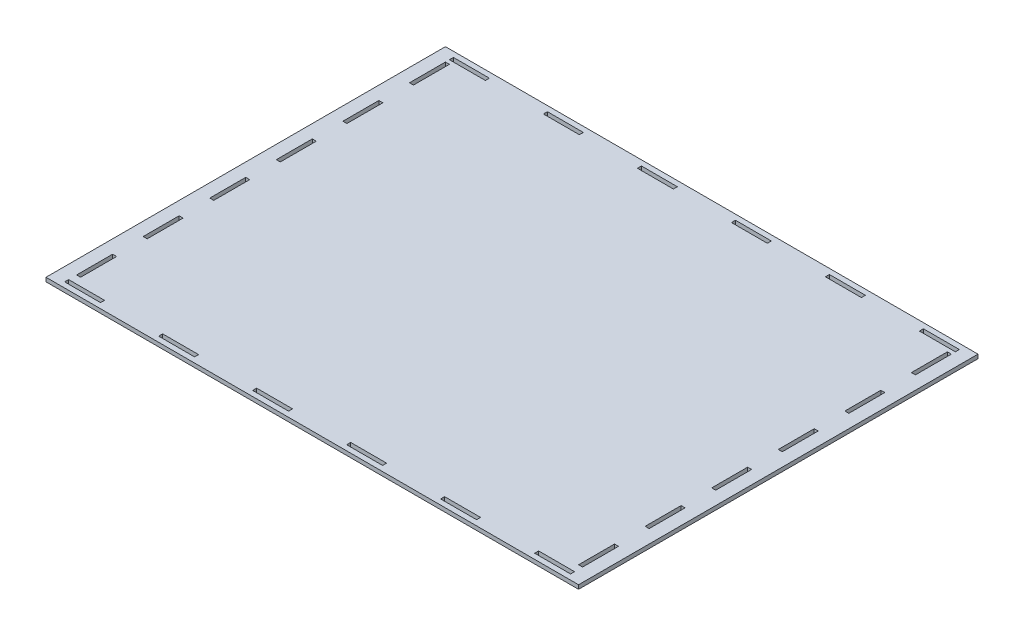
from build123d import *

# Parameters (mm, degrees)
SKETCH1_W           = 400
SKETCH1_H           = 300
BOSS_EXTRUDE2_DEPTH = 3
SKETCH5_W           = 3
SKETCH5_H           = 27
CUT_EXTRUDE4_DEPTH  = 3
SKETCH6_W           = 3
SKETCH6_H           = 27
CUT_EXTRUDE5_DEPTH  = 3
SKETCH12_W          = 27
SKETCH12_H          = 3
CUT_EXTRUDE10_DEPTH = 10
SKETCH13_W          = 27
SKETCH13_H          = 3
CUT_EXTRUDE11_DEPTH = 10


with BuildPart() as part:
    # Sketch1 → Boss-Extrude2 (new body)
    with BuildSketch(Plane(origin=(0, 0, 0), x_dir=(1, 0, 0), z_dir=(0, 1, 0))):
        Rectangle(SKETCH1_W, SKETCH1_H)
    extrude(amount=BOSS_EXTRUDE2_DEPTH)

    # Sketch5 → Cut-Extrude4 (cut)
    with BuildSketch(Plane(origin=(0, 3, 0), x_dir=(1, 0, 0), z_dir=(0, 1, 0))):
        with Locations((-188.5, 126.5)):
            Rectangle(SKETCH5_W, SKETCH5_H)
        with Locations((-188.5, 76.5)):
            Rectangle(SKETCH5_W, SKETCH5_H)
        with Locations((-188.5, 26.5)):
            Rectangle(SKETCH5_W, SKETCH5_H)
        with Locations((-188.5, -23.5)):
            Rectangle(SKETCH5_W, SKETCH5_H)
        with Locations((-188.5, -73.5)):
            Rectangle(SKETCH5_W, SKETCH5_H)
        with Locations((-188.5, -123.5)):
            Rectangle(SKETCH5_W, SKETCH5_H)
    extrude(amount=-CUT_EXTRUDE4_DEPTH, mode=Mode.SUBTRACT)

    # Sketch6 → Cut-Extrude5 (cut)
    with BuildSketch(Plane(origin=(0, 3, 0), x_dir=(1, 0, 0), z_dir=(0, 1, 0))):
        with Locations((188.5, 126.5)):
            Rectangle(SKETCH6_W, SKETCH6_H)
        with Locations((188.5, 76.5)):
            Rectangle(SKETCH6_W, SKETCH6_H)
        with Locations((188.5, 26.5)):
            Rectangle(SKETCH6_W, SKETCH6_H)
        with Locations((188.5, -23.5)):
            Rectangle(SKETCH6_W, SKETCH6_H)
        with Locations((188.5, -73.5)):
            Rectangle(SKETCH6_W, SKETCH6_H)
        with Locations((188.5, -123.5)):
            Rectangle(SKETCH6_W, SKETCH6_H)
    extrude(amount=-CUT_EXTRUDE5_DEPTH, mode=Mode.SUBTRACT)

    # Sketch12 → Cut-Extrude10 (cut)
    with BuildSketch(Plane.XZ):
        with Locations((-176.5, -144.5)):
            Rectangle(SKETCH12_W, SKETCH12_H)
        with Locations((-105.9, -144.5)):
            Rectangle(SKETCH12_W, SKETCH12_H)
        with Locations((-35.3, -144.5)):
            Rectangle(SKETCH12_W, SKETCH12_H)
        with Locations((35.3, -144.5)):
            Rectangle(SKETCH12_W, SKETCH12_H)
        with Locations((105.9, -144.5)):
            Rectangle(SKETCH12_W, SKETCH12_H)
        with Locations((176.5, -144.5)):
            Rectangle(SKETCH12_W, SKETCH12_H)
    extrude(amount=-CUT_EXTRUDE10_DEPTH, mode=Mode.SUBTRACT)

    # Sketch13 → Cut-Extrude11 (cut)
    with BuildSketch(Plane(origin=(0, 0, 0), x_dir=(-1, 0, 0), z_dir=(0, -1, 0))):
        with Locations((176.5, -144.5)):
            Rectangle(SKETCH13_W, SKETCH13_H)
        with Locations((105.9, -144.5)):
            Rectangle(SKETCH13_W, SKETCH13_H)
        with Locations((35.3, -144.5)):
            Rectangle(SKETCH13_W, SKETCH13_H)
        with Locations((-35.3, -144.5)):
            Rectangle(SKETCH13_W, SKETCH13_H)
        with Locations((-105.9, -144.5)):
            Rectangle(SKETCH13_W, SKETCH13_H)
        with Locations((-176.5, -144.5)):
            Rectangle(SKETCH13_W, SKETCH13_H)
    extrude(amount=-CUT_EXTRUDE11_DEPTH, mode=Mode.SUBTRACT)


solid = part.part
